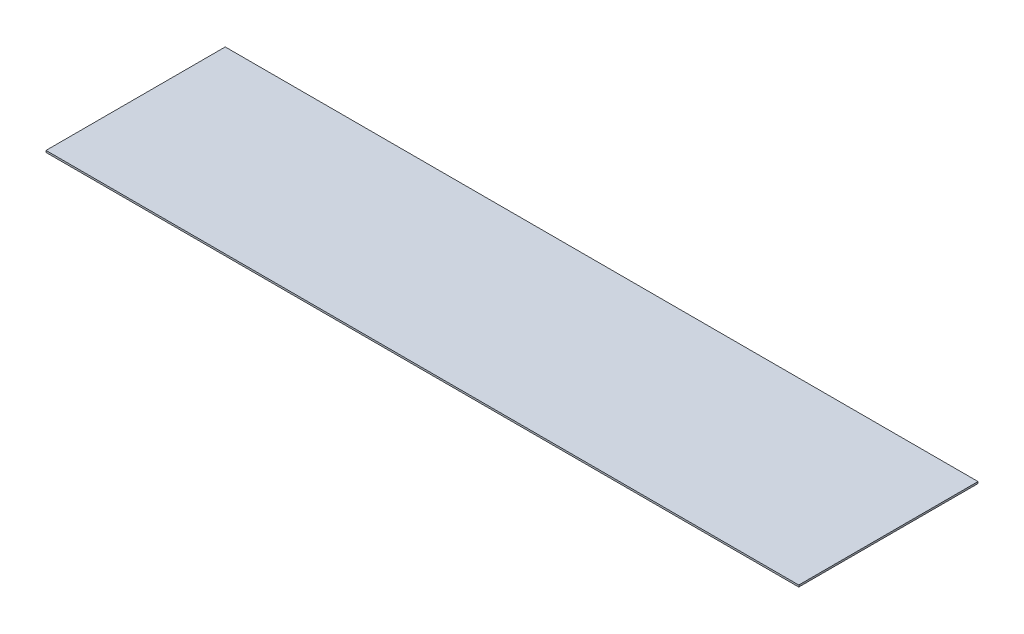
from build123d import *

# Parameters (mm, degrees)
SKETCH1_W           = 210
SKETCH1_H           = 50
BOSS_EXTRUDE1_DEPTH = 0.5


with BuildPart() as part:
    # Sketch1 → Boss-Extrude1 (new body)
    with BuildSketch(Plane(origin=(0, 0, 0), x_dir=(1, 0, 0), z_dir=(0, 1, 0))):
        Rectangle(SKETCH1_W, SKETCH1_H)
    extrude(amount=BOSS_EXTRUDE1_DEPTH)


solid = part.part
